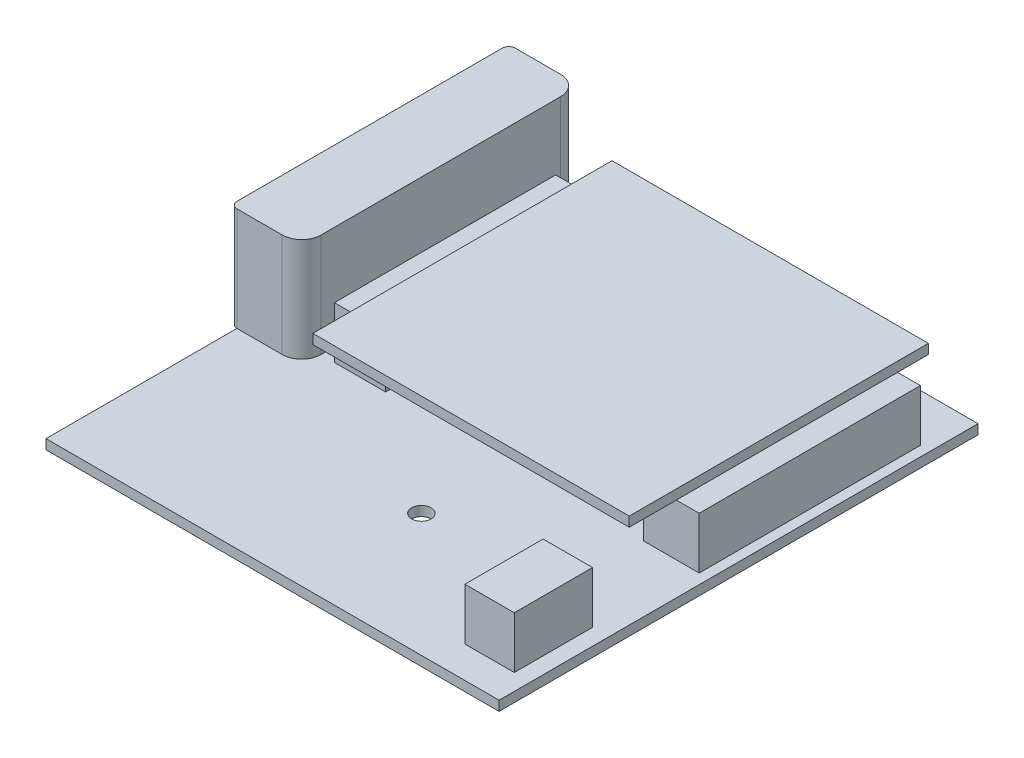
from build123d import *

# Parameters (mm, degrees)
SKETCH_1_W      = 70
SKETCH_1_H      = 74
SKETCH_1_R      = 1.5
EXTRUDE_1_DEPTH = 1.5
EXTRUDE_2_DEPTH = 16
SKETCH_3_W      = 7.90187143
SKETCH_3_H      = 34.179510185
SKETCH_3_W_2    = 8.610784302
SKETCH_3_W_3    = 7.635032944
SKETCH_3_H_2    = 12.090105775
EXTRUDE_3_DEPTH = 8
SKETCH_4_W      = 48.879724418
SKETCH_4_H      = 46.217704607
EXTRUDE_4_DEPTH = 1.5


with BuildPart() as part:
    # 草图1 → 凸台-拉伸1 (new body)
    with BuildSketch(Plane(origin=(0, 0, 0), x_dir=(1, 0, 0), z_dir=(0, 1, 0))):
        Rectangle(SKETCH_1_W, SKETCH_1_H)
        with Locations(Location((4, 22, 0), (0, 0, 270))):
            Circle(SKETCH_1_R, mode=Mode.SUBTRACT)
        with Locations(Location((-12, 2, 0), (0, 0, 270))):
            Circle(SKETCH_1_R, mode=Mode.SUBTRACT)
        with Locations(Location((20, 2, 0), (0, 0, 270))):
            Circle(SKETCH_1_R, mode=Mode.SUBTRACT)
        with Locations(Location((4, -18, 0), (0, 0, 270))):
            Circle(SKETCH_1_R, mode=Mode.SUBTRACT)
    extrude(amount=EXTRUDE_1_DEPTH)

    # 草图2 → 凸台-拉伸2 (add)
    with BuildSketch(Plane(origin=(0, 1.5, 0), x_dir=(1, 0, 0), z_dir=(0, 1, 0))):
        with BuildLine():
            Line((-35, 35.5), (-28, 35.5))
            ThreePointArc((-28, 35.5), (-25.878679656, 34.621320344), (-25, 32.5))
            Line((-25, 32.5), (-25, -4.5))
            ThreePointArc((-25, -4.5), (-25.878679656, -6.621320344), (-28, -7.5))
            Line((-28, -7.5), (-35, -7.5))
            ThreePointArc((-35, -7.5), (-35.707106781, -7.207106781), (-36, -6.5))
            Line((-36, -6.5), (-36, 34.5))
            ThreePointArc((-36, 34.5), (-35.707106781, 35.207106781), (-35, 35.5))
        make_face()
    extrude(amount=EXTRUDE_2_DEPTH)

    # 草图3 → 凸台-拉伸3 (add)
    with BuildSketch(Plane(origin=(0, 1.5, 0), x_dir=(1, 0, 0), z_dir=(0, 1, 0))):
        with Locations((-18.962737702, 12.563109243)):
            Rectangle(SKETCH_3_W, SKETCH_3_H)
        with Locations((29.139365584, 12.563109243)):
            Rectangle(SKETCH_3_W_2, SKETCH_3_H)
        with Locations((28.656584238, -26.076525333)):
            Rectangle(SKETCH_3_W_3, SKETCH_3_H_2)
    extrude(amount=EXTRUDE_3_DEPTH)

    # 草图4 → 凸台-拉伸4 (add)
    with BuildSketch(Plane(origin=(0, 9.5, 0), x_dir=(1, 0, 0), z_dir=(0, 1, 0))):
        with Locations((5.477124507, 11.306310679)):
            Rectangle(SKETCH_4_W, SKETCH_4_H)
    extrude(amount=EXTRUDE_4_DEPTH)


solid = part.part
